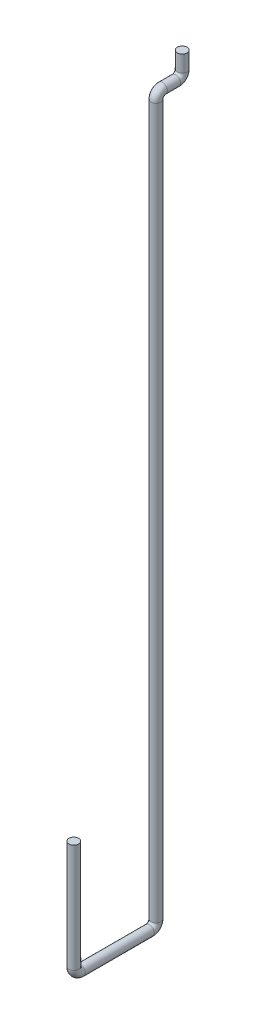
from build123d import *

# Parameters (mm, degrees)
SKETCH_3_R = 1.5


with BuildPart() as part:
    # По траектории1: sweep along a path in Эскиз1
    with BuildLine(Plane(origin=(0, 0, 0), x_dir=(0, 0, -1), z_dir=(1, 0, 0))) as sweep_1_path:
        Line((0, 0), (0, -5))
        ThreePointArc((0, -5), (-0.585786438, -6.414213562), (-2, -7))
        Line((-2, -7), (-6, -7))
        ThreePointArc((-6, -7), (-7.414213562, -7.585786438), (-8, -9))
        Line((-8, -9), (-8, -225))
        ThreePointArc((-8, -225), (-8.585786438, -226.414213562), (-10, -227))
        Line((-10, -227), (-31, -227))
        ThreePointArc((-31, -227), (-32.414213562, -226.414213562), (-33, -225))
        Line((-33, -225), (-33, -192))
    # Эскиз3 → По траектории1 (sweep)
    with BuildSketch(Plane(origin=(0, 0, 0), x_dir=(1, 0, 0), z_dir=(0, 1, 0))):
        Circle(SKETCH_3_R)
    sweep(path=sweep_1_path.line)


solid = part.part
